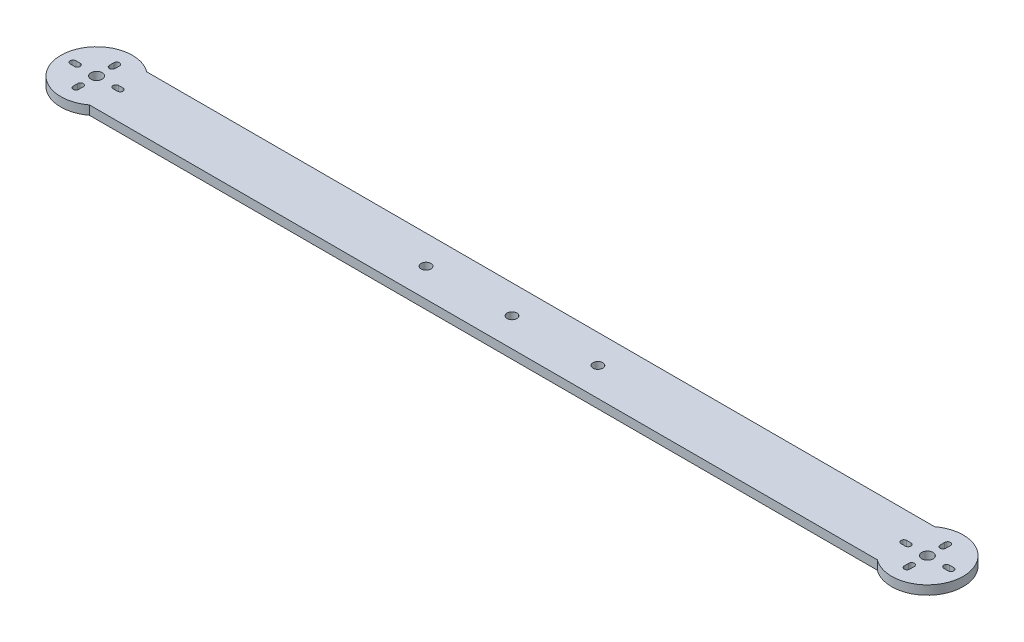
from build123d import *

# Parameters (mm, degrees)
BOSS_EXTRUDE1_DEPTH = 4
SKETCH2_R           = 2.5
CUT_EXTRUDE1_DEPTH  = 201.6938371
SKETCH3_R           = 2.159
CUT_EXTRUDE2_DEPTH  = 201.6938371


with BuildPart() as part:
    # Sketch1 → Boss-Extrude1 (new body)
    with BuildSketch(Plane(origin=(0, 0, 0), x_dir=(1, 0, 0), z_dir=(0, 1, 0))):
        with BuildLine():
            Line((-174.625, 12.7), (174.625, 12.7))
            ThreePointArc((174.625, 12.7), (200.025, 0), (174.625, -12.7))
            Line((174.625, -12.7), (-174.625, -12.7))
            ThreePointArc((-174.625, -12.7), (-200.025, 0), (-174.625, 12.7))
        make_face()
    extrude(amount=BOSS_EXTRUDE1_DEPTH)

    # Sketch2 → Cut-Extrude1 (cut, through all)
    with BuildSketch(Plane(origin=(0, 4, 0), x_dir=(1, 0, 0), z_dir=(0, 1, 0))):
        with Locations(Location((184.15, 0, 0), (0, 0, 270))):
            Circle(SKETCH2_R)
        with Locations(Location((-184.15, 0, 0), (0, 0, 90))):
            Circle(SKETCH2_R)
        with BuildLine():
            Line((173.691383345, 1.25), (175.608616655, 1.25))
            ThreePointArc((175.608616655, 1.25), (176.858616655, 0), (175.608616655, -1.25))
            Line((175.608616655, -1.25), (173.691383345, -1.25))
            ThreePointArc((173.691383345, -1.25), (172.441383345, 0), (173.691383345, 1.25))
        make_face()
        with BuildLine():
            Line((194.608616655, 1.25), (192.691383345, 1.25))
            ThreePointArc((192.691383345, 1.25), (191.441383345, 0), (192.691383345, -1.25))
            Line((192.691383345, -1.25), (194.608616655, -1.25))
            ThreePointArc((194.608616655, -1.25), (195.858616655, 0), (194.608616655, 1.25))
        make_face()
        with BuildLine():
            Line((185.4, 8.920928665), (185.4, 6.921035691))
            ThreePointArc((185.4, 6.921035691), (184.15, 5.671035691), (182.9, 6.921035691))
            Line((182.9, 6.921035691), (182.9, 8.920928665))
            ThreePointArc((182.9, 8.920928665), (184.15, 10.170928665), (185.4, 8.920928665))
        make_face()
        with BuildLine():
            Line((185.441381345, -9.078964309), (185.441381345, -7.078964309))
            ThreePointArc((185.441381345, -7.078964309), (184.191381345, -5.828964309), (182.941381345, -7.078964309))
            Line((182.941381345, -7.078964309), (182.941381345, -9.078964309))
            ThreePointArc((182.941381345, -9.078964309), (184.191381345, -10.328964309), (185.441381345, -9.078964309))
        make_face()
        with BuildLine():
            Line((-185.441381345, -9.078964309), (-185.441381345, -7.078964309))
            ThreePointArc((-185.441381345, -7.078964309), (-184.191381345, -5.828964309), (-182.941381345, -7.078964309))
            Line((-182.941381345, -7.078964309), (-182.941381345, -9.078964309))
            ThreePointArc((-182.941381345, -9.078964309), (-184.191381345, -10.328964309), (-185.441381345, -9.078964309))
        make_face()
        with BuildLine():
            Line((-185.4, 8.920928665), (-185.4, 6.921035691))
            ThreePointArc((-185.4, 6.921035691), (-184.15, 5.671035691), (-182.9, 6.921035691))
            Line((-182.9, 6.921035691), (-182.9, 8.920928665))
            ThreePointArc((-182.9, 8.920928665), (-184.15, 10.170928665), (-185.4, 8.920928665))
        make_face()
        with BuildLine():
            Line((-194.608616655, 1.25), (-192.691383345, 1.25))
            ThreePointArc((-192.691383345, 1.25), (-191.441383345, 0), (-192.691383345, -1.25))
            Line((-192.691383345, -1.25), (-194.608616655, -1.25))
            ThreePointArc((-194.608616655, -1.25), (-195.858616655, 0), (-194.608616655, 1.25))
        make_face()
        with BuildLine():
            Line((-173.691383345, 1.25), (-175.608616655, 1.25))
            ThreePointArc((-175.608616655, 1.25), (-176.858616655, 0), (-175.608616655, -1.25))
            Line((-175.608616655, -1.25), (-173.691383345, -1.25))
            ThreePointArc((-173.691383345, -1.25), (-172.441383345, 0), (-173.691383345, 1.25))
        make_face()
    extrude(amount=-CUT_EXTRUDE1_DEPTH, mode=Mode.SUBTRACT)

    # Sketch3 → Cut-Extrude2 (cut, through all)
    with BuildSketch(Plane(origin=(0, 4, 0), x_dir=(1, 0, 0), z_dir=(0, 1, 0))):
        with Locations(Location((0, 0, 0), (0, 0, 270))):
            Circle(SKETCH3_R)
        with Locations(Location((38.1, 0, 0), (0, 0, 270))):
            Circle(SKETCH3_R)
        with Locations(Location((-38.1, 0, 0), (0, 0, 270))):
            Circle(SKETCH3_R)
    extrude(amount=-CUT_EXTRUDE2_DEPTH, mode=Mode.SUBTRACT)


solid = part.part
